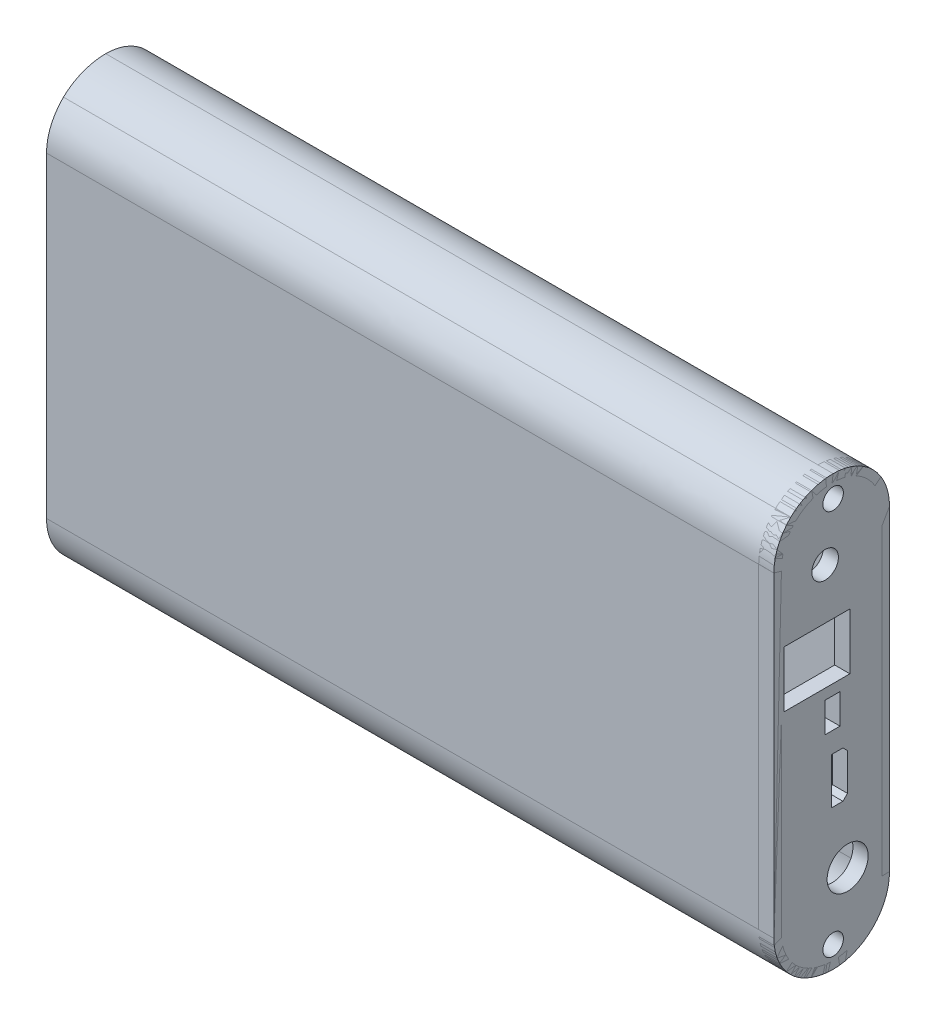
from build123d import *

# Parameters (mm, degrees)
BOSS_EXTRUDE1_DEPTH = 121.6
SHELL1_T            = -1.27
SKETCH1_3_R         = 1.7144
SKETCH1_3_R_2       = 3.2384
SKETCH1_3_R_3       = 3.4289
SKETCH1_3_R_4       = 1.714400001
BOSS_EXTRUDE2_DEPTH = 2.54
SKETCH3_R           = 3.4289
SKETCH3_R_2         = 1.7144
SKETCH3_R_3         = 2.2226
SKETCH3_W           = 11.0235
SKETCH3_H           = 9.398
SKETCH3_W_2         = 2.4891
SKETCH3_H_2         = 5.0037
BOSS_EXTRUDE3_DEPTH = 2.54


with BuildPart() as part:
    # Sketch1 → Boss-Extrude1 (new body)
    with BuildSketch(Plane(origin=(0, 0, 0), x_dir=(0, 0, -1), z_dir=(1, 0, 0))):
        with BuildLine():
            Line((-9.900747389, 9.441055173), (-9.90045261, 62.339455172))
            add(Edge.make_bspline(
                [(-9.90045261, 62.339455172), (-9.898838581, 64.857055163), (-8.867625171, 67.263549416), (-7.06561538, 69.020539375)],
                knots=[0.8, 0.8, 0.8, 0.8, 0.9, 0.9, 0.9, 0.9], degree=3))
            add(Edge.make_bspline(
                [(-7.06561538, 69.020539375), (-5.240005459, 70.800829201), (-2.546599991, 71.782014192), (0.0002, 71.7804)],
                knots=[0.9, 0.9, 0.9, 0.9, 1, 1, 1, 1], degree=3))
            add(Edge.make_bspline(
                [(0.0002, 71.7804), (2.499599992, 71.778886072), (4.907794441, 70.782872652), (6.673284577, 69.012762814)],
                knots=[0, 0, 0, 0, 0.1, 0.1, 0.1, 0.1], degree=3))
            add(Edge.make_bspline(
                [(6.673284577, 69.012762814), (8.439774708, 67.24175297), (9.430561329, 64.840747449), (9.428947389, 62.339347458)],
                knots=[0.1, 0.1, 0.1, 0.1, 0.2, 0.2, 0.2, 0.2], degree=3))
            Line((9.428947389, 62.339347458), (9.42865261, 9.440947458))
            add(Edge.make_bspline(
                [(9.42865261, 9.440947458), (9.427038673, 6.939947467), (8.433625234, 4.528253003), (6.664515376, 2.759162862)],
                knots=[0.3, 0.3, 0.3, 0.3, 0.4, 0.4, 0.4, 0.4], degree=3))
            add(Edge.make_bspline(
                [(6.664515376, 2.759162862), (4.897005525, 0.991472711), (2.499699991, -0.00161393), (0, 0)],
                knots=[0.4, 0.4, 0.4, 0.4, 0.5, 0.5, 0.5, 0.5], degree=3))
            add(Edge.make_bspline(
                [(0, 0), (-2.547299992, 0.001514195), (-5.252194502, 0.986629268), (-7.074884573, 2.768439425)],
                knots=[0.5, 0.5, 0.5, 0.5, 0.6, 0.6, 0.6, 0.6], degree=3))
            add(Edge.make_bspline(
                [(-7.074884573, 2.768439425), (-8.873774774, 4.52684945), (-9.902361421, 6.923055182), (-9.900747389, 9.441055173)],
                knots=[0.6, 0.6, 0.6, 0.6, 0.7, 0.7, 0.7, 0.7], degree=3))
        make_face()
    extrude(amount=BOSS_EXTRUDE1_DEPTH)

    # Shell1
    shell1_openings = [part.faces().sort_by_distance(p)[0] for p in [
        (121.6, 35.890229299, 0.230902193),
        (0, 35.890229299, 0.230902193),
    ]]
    offset(amount=SHELL1_T, openings=shell1_openings, kind=Kind.INTERSECTION)

    # Sketch1<3> → Boss-Extrude2 (add)
    with BuildSketch(Plane(origin=(0, 0, 0), x_dir=(0, 0, -1), z_dir=(1, 0, 0))):
        with BuildLine():
            Line((-9.900747389, 9.441055173), (-9.90045261, 62.339455172))
            add(Edge.make_bspline(
                [(-9.90045261, 62.339455172), (-9.898838581, 64.857055163), (-8.867625171, 67.263549416), (-7.06561538, 69.020539375)],
                knots=[0.8, 0.8, 0.8, 0.8, 0.9, 0.9, 0.9, 0.9], degree=3))
            add(Edge.make_bspline(
                [(-7.06561538, 69.020539375), (-5.240005459, 70.800829201), (-2.546599991, 71.782014192), (0.0002, 71.7804)],
                knots=[0.9, 0.9, 0.9, 0.9, 1, 1, 1, 1], degree=3))
            add(Edge.make_bspline(
                [(0.0002, 71.7804), (2.499599992, 71.778886072), (4.907794441, 70.782872652), (6.673284577, 69.012762814)],
                knots=[0, 0, 0, 0, 0.1, 0.1, 0.1, 0.1], degree=3))
            add(Edge.make_bspline(
                [(6.673284577, 69.012762814), (8.439774708, 67.24175297), (9.430561329, 64.840747449), (9.428947389, 62.339347458)],
                knots=[0.1, 0.1, 0.1, 0.1, 0.2, 0.2, 0.2, 0.2], degree=3))
            Line((9.428947389, 62.339347458), (9.42865261, 9.440947458))
            add(Edge.make_bspline(
                [(9.42865261, 9.440947458), (9.427038673, 6.939947467), (8.433625234, 4.528253003), (6.664515376, 2.759162862)],
                knots=[0.3, 0.3, 0.3, 0.3, 0.4, 0.4, 0.4, 0.4], degree=3))
            add(Edge.make_bspline(
                [(6.664515376, 2.759162862), (4.897005525, 0.991472711), (2.499699991, -0.00161393), (0, 0)],
                knots=[0.4, 0.4, 0.4, 0.4, 0.5, 0.5, 0.5, 0.5], degree=3))
            add(Edge.make_bspline(
                [(0, 0), (-2.547299992, 0.001514195), (-5.252194502, 0.986629268), (-7.074884573, 2.768439425)],
                knots=[0.5, 0.5, 0.5, 0.5, 0.6, 0.6, 0.6, 0.6], degree=3))
            add(Edge.make_bspline(
                [(-7.074884573, 2.768439425), (-8.873774774, 4.52684945), (-9.902361421, 6.923055182), (-9.900747389, 9.441055173)],
                knots=[0.6, 0.6, 0.6, 0.6, 0.7, 0.7, 0.7, 0.7], degree=3))
        make_face()
        with Locations((0.00567983, 68.160799969)):
            Circle(SKETCH1_3_R, mode=Mode.SUBTRACT)
        with Locations((0.271601308, 54.070098487)):
            Circle(SKETCH1_3_R_2, mode=Mode.SUBTRACT)
        with Locations((0.271530537, 41.370098488)):
            Circle(SKETCH1_3_R_2, mode=Mode.SUBTRACT)
        with Locations((0.271458846, 28.505098488)):
            Circle(SKETCH1_3_R_2, mode=Mode.SUBTRACT)
        with Locations((2.430375473, 13.543686457)):
            Circle(SKETCH1_3_R_3, mode=Mode.SUBTRACT)
        with Locations((0.00532017, 3.61954997)):
            Circle(SKETCH1_3_R_4, mode=Mode.SUBTRACT)
    extrude(amount=BOSS_EXTRUDE2_DEPTH)


with BuildPart() as body_2:
    # Sketch3 → Boss-Extrude3 (new body)
    with BuildSketch(Plane(origin=(121.6, 0, 0), x_dir=(0, 0, -1), z_dir=(1, 0, 0))):
        with BuildLine():
            Line((-9.90045261, 62.339455172), (-9.900747389, 9.441055173))
            add(Edge.make_bspline(
                [(-9.900747389, 9.441055173), (-9.902361421, 6.923055182), (-8.873774774, 4.52684945), (-7.074884573, 2.768439425)],
                knots=[0.6, 0.6, 0.6, 0.6, 0.7, 0.7, 0.7, 0.7], degree=3))
            add(Edge.make_bspline(
                [(-7.074884573, 2.768439425), (-5.252194502, 0.986629268), (-2.547299992, 0.001514195), (0, 0)],
                knots=[0.5, 0.5, 0.5, 0.5, 0.6, 0.6, 0.6, 0.6], degree=3))
            add(Edge.make_bspline(
                [(0, 0), (2.499699991, -0.00161393), (4.897005525, 0.991472711), (6.664515376, 2.759162862)],
                knots=[0.4, 0.4, 0.4, 0.4, 0.5, 0.5, 0.5, 0.5], degree=3))
            add(Edge.make_bspline(
                [(6.664515376, 2.759162862), (8.433625234, 4.528253003), (9.427038673, 6.939947467), (9.42865261, 9.440947458)],
                knots=[0.3, 0.3, 0.3, 0.3, 0.4, 0.4, 0.4, 0.4], degree=3))
            Line((9.42865261, 9.440947458), (9.428947389, 62.339347458))
            add(Edge.make_bspline(
                [(9.428947389, 62.339347458), (9.430561329, 64.840747449), (8.439774708, 67.24175297), (6.673284577, 69.012762814)],
                knots=[0.1, 0.1, 0.1, 0.1, 0.2, 0.2, 0.2, 0.2], degree=3))
            add(Edge.make_bspline(
                [(6.673284577, 69.012762814), (4.907794441, 70.782872652), (2.499599992, 71.778886072), (0.0002, 71.7804)],
                knots=[0, 0, 0, 0, 0.1, 0.1, 0.1, 0.1], degree=3))
            add(Edge.make_bspline(
                [(0.0002, 71.7804), (-2.546599991, 71.782014192), (-5.240005459, 70.800829201), (-7.06561538, 69.020539375)],
                knots=[0.9, 0.9, 0.9, 0.9, 1, 1, 1, 1], degree=3))
            add(Edge.make_bspline(
                [(-7.06561538, 69.020539375), (-8.867625171, 67.263549416), (-9.898838581, 64.857055163), (-9.90045261, 62.339455172)],
                knots=[0.8, 0.8, 0.8, 0.8, 0.9, 0.9, 0.9, 0.9], degree=3))
        make_face()
        with Locations((2.4271, 13.525)):
            Circle(SKETCH3_R, mode=Mode.SUBTRACT)
        with Locations((0.0055, 3.6196)):
            Circle(SKETCH3_R_2, mode=Mode.SUBTRACT)
        with Locations((-1.332, 59.2451)):
            Circle(SKETCH3_R_3, mode=Mode.SUBTRACT)
        with Locations((0.0055, 68.1609)):
            Circle(SKETCH3_R_2, mode=Mode.SUBTRACT)
        with Locations((-2.70365, 46.0941)):
            Rectangle(SKETCH3_W, SKETCH3_H, mode=Mode.SUBTRACT)
        Polygon((1.6443, 31.2465), (2.4063, 30.4845), (2.4063, 24.2869), (1.6443, 23.5249), (-0.2353, 23.5249), (-0.2353, 31.2465), align=None, mode=Mode.SUBTRACT)
        with Locations((-0.08755, 37.14695)):
            Rectangle(SKETCH3_W_2, SKETCH3_H_2, mode=Mode.SUBTRACT)
    extrude(amount=-BOSS_EXTRUDE3_DEPTH)


solid = Compound([part.part, body_2.part])
